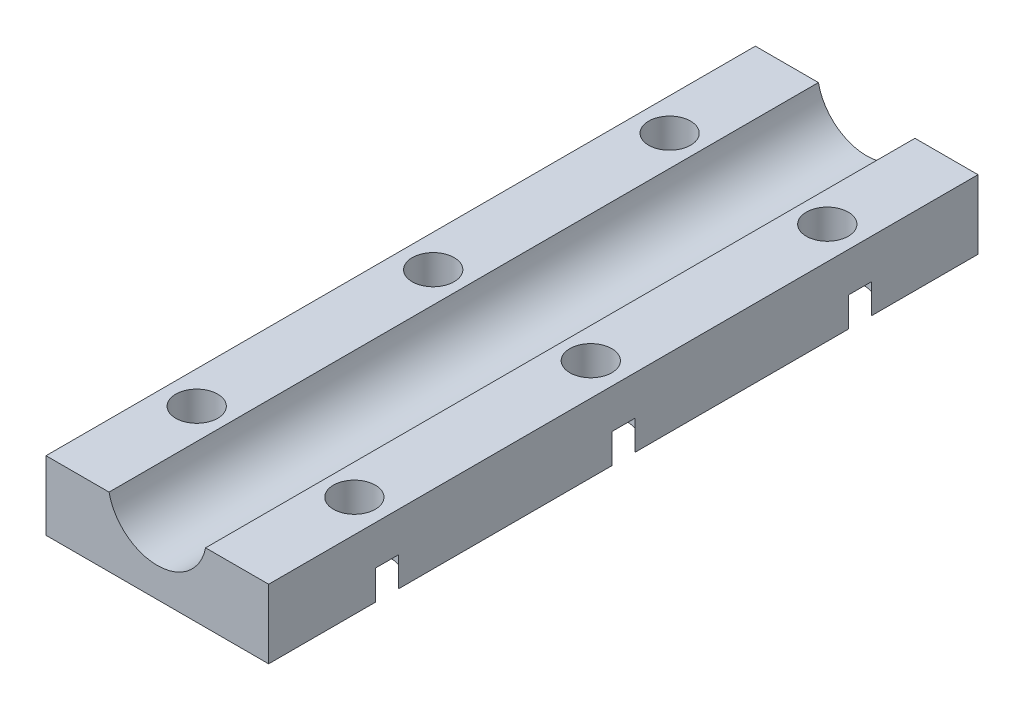
from build123d import *

# Parameters (mm, degrees)
STOCK_DEPTH                                      = 114.3
CBORE_FOR_1_4_SOCKET_HEAD_CAP_SCREW1_D           = 6.7564
CBORE_FOR_1_4_SOCKET_HEAD_CAP_SCREW1_CBORE_D     = 11.1125
CBORE_FOR_1_4_SOCKET_HEAD_CAP_SCREW1_CBORE_DEPTH = 6.35
CHAMFER1_SIZE                                    = 1.5875


with BuildPart() as part:
    # Sketch1 → stock (new body)
    with BuildSketch(Plane.XY):
        with BuildLine():
            Line((7.777129933, -1.5875), (17.937129933, -1.5875))
            Line((17.937129933, -1.5875), (17.937129933, -14.2875))
            Line((17.937129933, -14.2875), (-17.937129933, -14.2875))
            Line((-17.937129933, -14.2875), (-17.937129933, -1.5875))
            Line((-17.937129933, -1.5875), (-7.777129933, -1.5875))
            ThreePointArc((-7.777129933, -1.5875), (0, -7.9375), (7.777129933, -1.5875))
        make_face()
    extrude(amount=STOCK_DEPTH)

    # CBORE for 1/4 Socket Head Cap Screw1 (through all)
    with Locations(Plane(origin=(0, -14.2875, 0), x_dir=(-1, 0, 0), z_dir=(0, -1, 0))):
        with Locations((12.7, -19.05), (12.7, -57.15), (12.7, -95.25), (-12.7, -95.25), (-12.7, -57.15), (-12.7, -19.05)):
            CounterBoreHole(CBORE_FOR_1_4_SOCKET_HEAD_CAP_SCREW1_D / 2, CBORE_FOR_1_4_SOCKET_HEAD_CAP_SCREW1_CBORE_D / 2, CBORE_FOR_1_4_SOCKET_HEAD_CAP_SCREW1_CBORE_DEPTH)

    # Chamfer1
    chamfer1_edges = [part.edges().sort_by_distance(p)[0] for p in [
        (17.937129933, -14.2875, 105.702952602),
        (-17.937129933, -14.2875, 105.702952602),
        (17.937129933, -14.2875, 8.597047398),
        (7.14375, -14.2875, 19.05),
        (17.937129933, -14.2875, 38.1),
        (7.14375, -14.2875, 57.15),
        (0, -14.2875, 114.3),
        (17.937129933, -14.2875, 76.2),
        (7.14375, -14.2875, 95.25),
        (-17.937129933, -14.2875, 76.2),
        (-7.14375, -14.2875, 95.25),
        (-17.937129933, -14.2875, 38.1),
        (-7.14375, -14.2875, 57.15),
        (0, -14.2875, 0),
        (-17.937129933, -14.2875, 8.597047398),
        (-7.14375, -14.2875, 19.05),
    ]]
    chamfer(chamfer1_edges, length=CHAMFER1_SIZE)


solid = part.part
